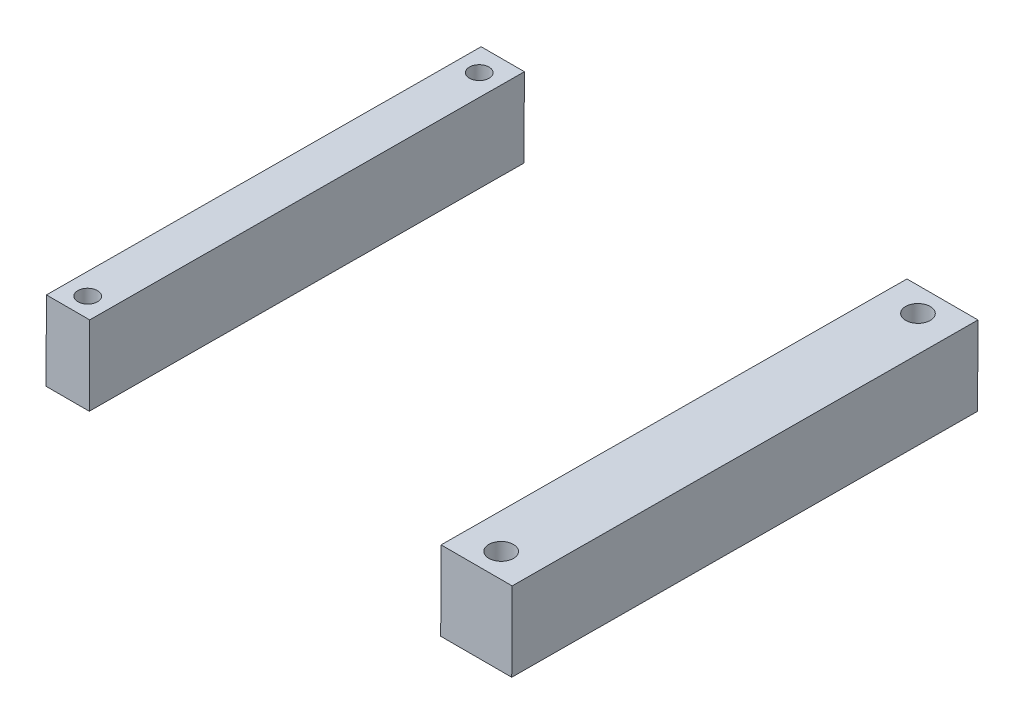
from build123d import *

# Parameters (mm, degrees)
SKETCH1_W             = 23
SKETCH1_H             = 150.8
SKETCH1_R             = 3.96875
BOSS_EXTRUDE1_DEPTH   = 25.55
SKETCH1_W_2           = 14
SKETCH1_H_2           = 140.727572026
SKETCH1_R_2           = 3.175
BOSS_EXTRUDE1_2_DEPTH = 25.55


with BuildPart() as part:
    # Sketch1 → Boss-Extrude1 (new body)
    with BuildSketch(Plane(origin=(0, 299.932186835, -1.669195554), x_dir=(1, 0, 0), z_dir=(0, 0.9999845143939402, -0.005565156989320752))):
        with Locations((69, 951.225787333)):
            Rectangle(SKETCH1_W, SKETCH1_H)
        with Locations(Location((69, 883.763287333, 0), (0, 0, 90))):
            Circle(SKETCH1_R, mode=Mode.SUBTRACT)
        with Locations(Location((69, 1018.688287333, 0), (0, 0, 90))):
            Circle(SKETCH1_R, mode=Mode.SUBTRACT)
    extrude(amount=BOSS_EXTRUDE1_DEPTH)


with BuildPart() as body_2:
    # Sketch1 → Boss-Extrude1 2 (new body)
    with BuildSketch(Plane(origin=(0, 299.932186835, -1.669195554), x_dir=(1, 0, 0), z_dir=(0, 0.9999845143939402, -0.005565156989320752))):
        with Locations((-69.5, 952.42200132)):
            Rectangle(SKETCH1_W_2, SKETCH1_H_2)
        with Locations(Location((-69.5, 1015.165787333, 0), (0, 0, 90))):
            Circle(SKETCH1_R_2, mode=Mode.SUBTRACT)
        with Locations(Location((-69.5, 888.408215307, 0), (0, 0, 90))):
            Circle(SKETCH1_R_2, mode=Mode.SUBTRACT)
    extrude(amount=BOSS_EXTRUDE1_2_DEPTH)


solid = Compound([part.part, body_2.part])
